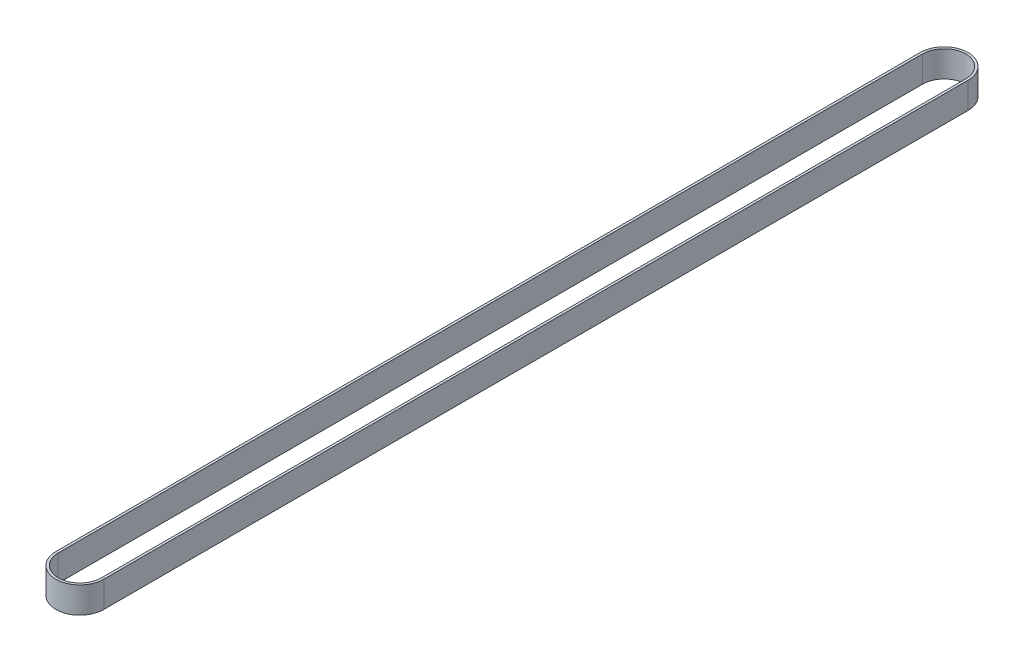
from build123d import *

# Parameters (mm, degrees)
BOSS_EXTRUDE1_DEPTH = 11


with BuildPart() as part:
    # Sketch1 → Boss-Extrude1 (new body)
    with BuildSketch(Plane(origin=(0, 0, 0), x_dir=(1, 0, 0), z_dir=(0, 1, 0))):
        with BuildLine():
            Line((-10.05, 0), (-10.05, -362.5))
            ThreePointArc((-10.05, -362.5), (0, -372.55), (10.05, -362.5))
            Line((10.05, -362.5), (10.05, 0))
            ThreePointArc((10.05, 0), (0, 10.05), (-10.05, 0))
        make_face()
        with BuildLine():
            Line((-9.05, 0), (-9.05, -362.5))
            ThreePointArc((-9.05, -362.5), (0, -371.55), (9.05, -362.5))
            Line((9.05, -362.5), (9.05, 0))
            ThreePointArc((9.05, 0), (0, 9.05), (-9.05, 0))
        make_face(mode=Mode.SUBTRACT)
    extrude(amount=BOSS_EXTRUDE1_DEPTH)


solid = part.part
